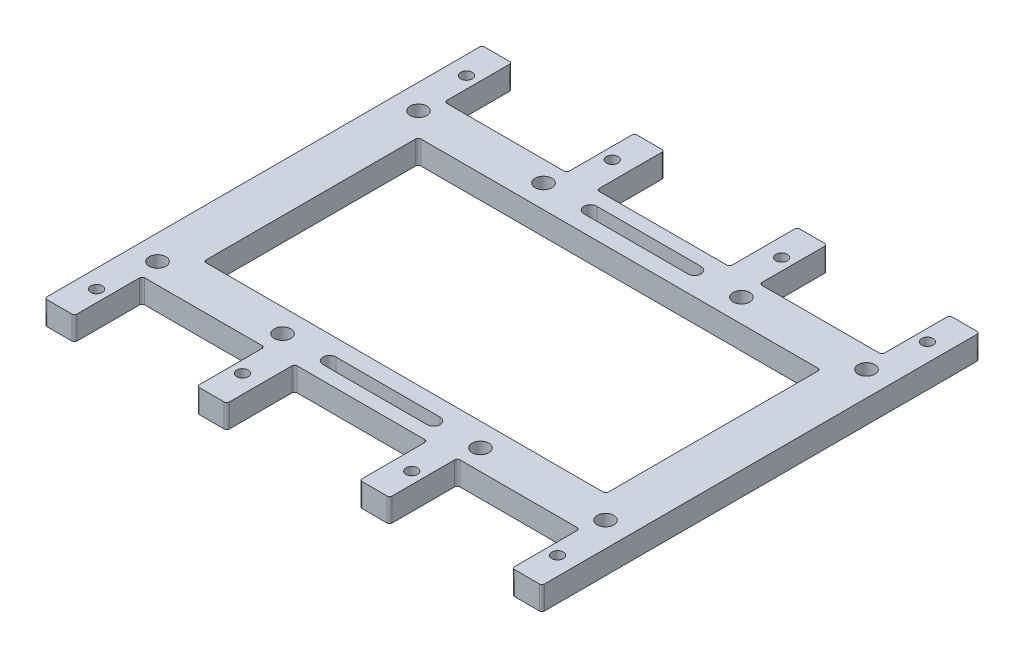
from build123d import *

# Parameters (mm, degrees)
EXTRUDE_1_DEPTH     = 4.5
SKETCH_10_W         = 77.2
SKETCH_10_H         = 41.2
CUT_EXTRUDE_5_DEPTH = 64.751960754
SKETCH_16_R         = 1.6
CUT_EXTRUDE_6_DEPTH = 10
SKETCH_17_R         = 1.1
CUT_EXTRUDE_7_DEPTH = 10
FILLET_1_R          = 0.5


with BuildPart() as part:
    # 草图1 → 凸台-拉伸1 (new body)
    with BuildSketch(Plane(origin=(0, 0, 0), x_dir=(1, 0, 0), z_dir=(0, 1, 0))):
        Polygon((-47.75, -29), (-47.75, -42), (-42, -42), (-42, -29), (-18.5, -29), (-18.5, -42), (-12.75, -42), (-12.75, -29), (12.75, -29), (12.75, -42), (18.5, -42), (18.5, -29), (42, -29), (42, -42), (47.75, -42), (47.75, -29), (47.75, 29), (47.75, 42), (42, 42), (42, 29), (18.5, 29), (18.5, 42), (12.75, 42), (12.75, 29), (-12.75, 29), (-12.75, 42), (-18.5, 42), (-18.5, 29), (-42, 29), (-42, 42), (-47.75, 42), (-47.75, 29), align=None)
    extrude(amount=-EXTRUDE_1_DEPTH)

    # 草图10 → 切除-拉伸5 (cut, through all)
    with BuildSketch(Plane(origin=(0, 0, 0), x_dir=(1, 0, 0), z_dir=(0, 1, 0))):
        Rectangle(SKETCH_10_W, SKETCH_10_H)
    extrude(amount=-CUT_EXTRUDE_5_DEPTH, mode=Mode.SUBTRACT)

    # 草图16 → 切除-拉伸6 (cut)
    with BuildSketch(Plane(origin=(0, 0, 0), x_dir=(1, 0, 0), z_dir=(0, 1, 0))):
        with Locations(Location((19, 25.05, 0), (0, 0, 270))):
            Circle(SKETCH_16_R)
        with Locations(Location((43, 25.05, 0), (0, 0, 270))):
            Circle(SKETCH_16_R)
        with Locations(Location((-43, 25.05, 0), (0, 0, 90))):
            Circle(SKETCH_16_R)
        with Locations(Location((-19, 25.05, 0), (0, 0, 90))):
            Circle(SKETCH_16_R)
        with Locations(Location((43, -25.05, 0), (0, 0, 90))):
            Circle(SKETCH_16_R)
        with Locations(Location((19, -25.05, 0), (0, 0, 90))):
            Circle(SKETCH_16_R)
        with Locations(Location((-19, -25.05, 0), (0, 0, 270))):
            Circle(SKETCH_16_R)
        with Locations(Location((-43, -25.05, 0), (0, 0, 270))):
            Circle(SKETCH_16_R)
        with BuildLine():
            Line((-10, 26.3), (10, 26.3))
            ThreePointArc((10, 26.3), (11.25, 25.05), (10, 23.8))
            Line((10, 23.8), (-10, 23.8))
            ThreePointArc((-10, 23.8), (-11.25, 25.05), (-10, 26.3))
        make_face()
        with BuildLine():
            Line((-10, -26.3), (10, -26.3))
            ThreePointArc((10, -26.3), (11.25, -25.05), (10, -23.8))
            Line((10, -23.8), (-10, -23.8))
            ThreePointArc((-10, -23.8), (-11.25, -25.05), (-10, -26.3))
        make_face()
    extrude(amount=-CUT_EXTRUDE_6_DEPTH, mode=Mode.SUBTRACT)

    # 草图17 → 切除-拉伸7 (cut)
    with BuildSketch(Plane(origin=(0, 0, 0), x_dir=(1, 0, 0), z_dir=(0, 1, 0))):
        with Locations(Location((-44.25, -35.5, 0), (0, 0, 270))):
            Circle(SKETCH_17_R)
        with Locations(Location((-16.25, -35.5, 0), (0, 0, 270))):
            Circle(SKETCH_17_R)
        with Locations(Location((16.25, -35.5, 0), (0, 0, 90))):
            Circle(SKETCH_17_R)
        with Locations(Location((44.25, -35.5, 0), (0, 0, 90))):
            Circle(SKETCH_17_R)
        with Locations(Location((44.25, 35.5, 0), (0, 0, 270))):
            Circle(SKETCH_17_R)
        with Locations(Location((-16.25, 35.5, 0), (0, 0, 90))):
            Circle(SKETCH_17_R)
        with Locations(Location((-44.25, 35.5, 0), (0, 0, 90))):
            Circle(SKETCH_17_R)
        with Locations(Location((16.25, 35.5, 0), (0, 0, 270))):
            Circle(SKETCH_17_R)
    extrude(amount=-CUT_EXTRUDE_7_DEPTH, mode=Mode.SUBTRACT)

    # 圆角1
    fillet_1_edges = [part.edges().sort_by_distance(p)[0] for p in [
        (47.75, -2.25, 42),
        (42, -2.25, 42),
        (42, -2.25, 29),
        (18.5, -2.25, 29),
        (18.5, -2.25, 42),
        (12.75, -2.25, 42),
        (12.75, -2.25, 29),
        (-12.75, -2.25, 29),
        (-12.75, -2.25, 42),
        (-18.5, -2.25, 42),
        (-18.5, -2.25, 29),
        (-42, -2.25, 29),
        (-42, -2.25, 42),
        (-47.75, -2.25, 42),
        (-47.75, -2.25, -42),
        (-42, -2.25, -42),
        (-42, -2.25, -29),
        (-18.5, -2.25, -29),
        (-18.5, -2.25, -42),
        (-12.75, -2.25, -42),
        (-12.75, -2.25, -29),
        (12.75, -2.25, -29),
        (12.75, -2.25, -42),
        (18.5, -2.25, -42),
        (18.5, -2.25, -29),
        (42, -2.25, -29),
        (42, -2.25, -42),
        (47.75, -2.25, -42),
        (-38.6, -2.25, 20.6),
        (-38.6, -2.25, -20.6),
        (38.6, -2.25, -20.6),
        (38.6, -2.25, 20.6),
    ]]
    fillet(fillet_1_edges, radius=FILLET_1_R)


solid = part.part
